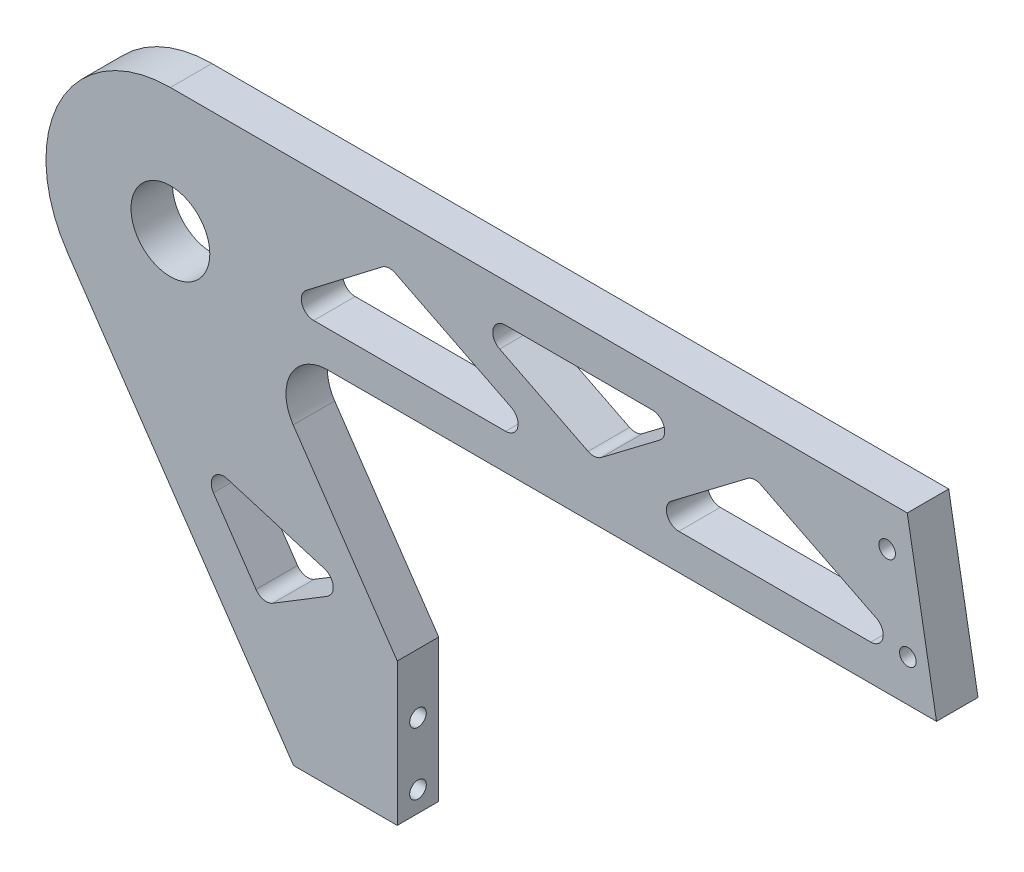
from build123d import *

# Parameters (mm, degrees)
SKETCH1_R           = 9.5
SKETCH1_R_2         = 2
BOSS_EXTRUDE2_DEPTH = 5
SKETCH2_R           = 2
CUT_EXTRUDE1_DEPTH  = 43.5


with BuildPart() as part:
    # Sketch1 → Boss-Extrude2 (new, symmetric)
    with BuildSketch(Plane.XY):
        with BuildLine():
            Line((0, 0), (-25, 0))
            Line((-25, 0), (-79.465738474, 79.800827522))
            ThreePointArc((-79.465738474, 79.800827522), (-81.213991187, 110.724247098), (-54.687026413, 126.712818196))
            Line((-54.687026413, 126.712818196), (122.946920772, 126.712818196))
            Line((122.946920772, 126.712818196), (130, 86.712818196))
            Line((130, 86.712818196), (-16.822273347, 86.712818196))
            ThreePointArc((-16.822273347, 86.712818196), (-25.664594939, 81.383294497), (-25.081844034, 71.075487971))
            Line((-25.081844034, 71.075487971), (0, 34.32666264))
            Line((0, 34.32666264), (0, 0))
        make_face()
        with Locations((-54.687026413, 96.712818196)):
            Circle(SKETCH1_R, mode=Mode.SUBTRACT)
        with Locations((118.092164461, 116.712818196)):
            Circle(SKETCH1_R_2, mode=Mode.SUBTRACT)
        with Locations((123.092164461, 96.712818196)):
            Circle(SKETCH1_R_2, mode=Mode.SUBTRACT)
        with BuildLine():
            Line((87.602603423, 114.955476372), (115.489324713, 101.027318395))
            ThreePointArc((115.489324713, 101.027318395), (117.068751792, 97.654829908), (114.148854559, 95.343451825))
            Line((114.148854559, 95.343451825), (67.87894889, 95.343451825))
            ThreePointArc((67.87894889, 95.343451825), (65.035223605, 97.387822973), (66.067251604, 100.734634156))
            Line((66.067251604, 100.734634156), (84.450435982, 114.662792133))
            ThreePointArc((84.450435982, 114.662792133), (85.984771107, 115.258760656), (87.602603423, 114.955476372))
        make_face(mode=Mode.SUBTRACT)
        with BuildLine():
            Line((-0.491145104, 115.057882008), (27.475527786, 101.02482381))
            ThreePointArc((27.475527786, 101.02482381), (29.049331009, 97.652118315), (26.130074601, 95.343451825))
            Line((26.130074601, 95.343451825), (-20.139831067, 95.343451825))
            ThreePointArc((-20.139831067, 95.343451825), (-22.980812237, 97.379695636), (-21.965173191, 100.724234497))
            Line((-21.965173191, 100.724234497), (-3.661940413, 114.757292695))
            ThreePointArc((-3.661940413, 114.757292695), (-2.119726939, 115.363119834), (-0.491145104, 115.057882008))
        make_face(mode=Mode.SUBTRACT)
        with BuildLine():
            Line((26.031042482, 117.478697139), (61.470853651, 117.478697139))
            ThreePointArc((61.470853651, 117.478697139), (64.314578937, 115.434325991), (63.282550938, 112.087514808))
            Line((63.282550938, 112.087514808), (49.162800513, 101.389579648))
            ThreePointArc((49.162800513, 101.389579648), (47.625690916, 100.793354809), (46.005650041, 101.099389994))
            Line((46.005650041, 101.099389994), (24.685589296, 111.797325153))
            ThreePointArc((24.685589296, 111.797325153), (23.111786073, 115.170030649), (26.031042482, 117.478697139))
        make_face(mode=Mode.SUBTRACT)
        with BuildLine():
            Line((-44.320136127, 47.300576318), (-34.048206361, 32.250592263))
            ThreePointArc((-34.048206361, 32.250592263), (-32.202518151, 31.009156908), (-30.009288975, 31.379929737))
            Line((-30.009288975, 31.379929737), (-16.865487004, 39.388981395))
            ThreePointArc((-16.865487004, 39.388981395), (-15.450916476, 42.332556513), (-17.56266475, 44.823773781))
            Line((-17.56266475, 44.823773781), (-40.978396488, 51.864706177))
            ThreePointArc((-40.978396488, 51.864706177), (-44.262816837, 50.76404185), (-44.320136127, 47.300576318))
        make_face(mode=Mode.SUBTRACT)
    extrude(amount=BOSS_EXTRUDE2_DEPTH, both=True)

    # Sketch2 → Cut-Extrude1 (cut, symmetric)
    with BuildSketch(Plane(origin=(0, 0, 0), x_dir=(0, 0, -1), z_dir=(1, 0, 0))):
        with Locations(Location((0, 5, 0), (0, 0, 90))):
            Circle(SKETCH2_R)
        with Locations(Location((0, 20, 0), (0, 0, 90))):
            Circle(SKETCH2_R)
    extrude(amount=CUT_EXTRUDE1_DEPTH, both=True, mode=Mode.SUBTRACT)


solid = part.part
